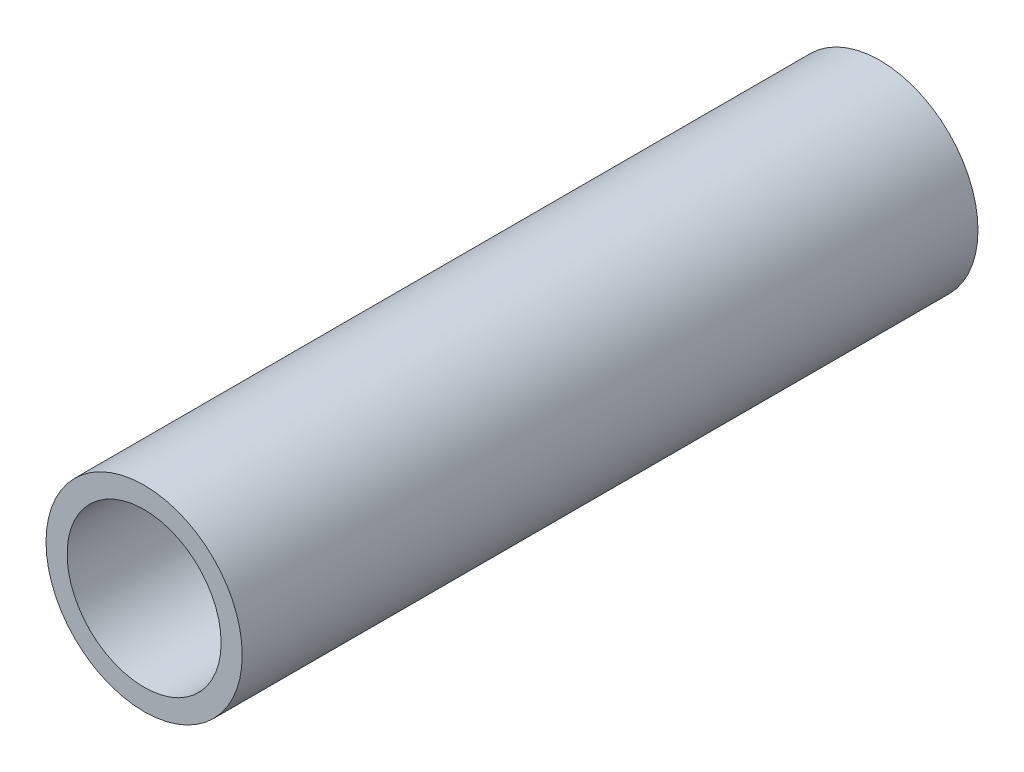
from build123d import *

# Parameters (mm, degrees)
BOSS_EXTRUDE1_DEPTH      = 50
BOSS_EXTRUDE1_DEPTH_BACK = 50
SKETCH3_R                = 13.335
SKETCH3_R_2              = 10.4648


with BuildPart() as part:
    # Sketch3 → Boss-Extrude1 (new, two sides: drawn at the far end of the back side and taken through both)
    with BuildSketch(Plane.XY.offset(-BOSS_EXTRUDE1_DEPTH_BACK)):
        Circle(SKETCH3_R)
        Circle(SKETCH3_R_2, mode=Mode.SUBTRACT)
    extrude(amount=BOSS_EXTRUDE1_DEPTH + BOSS_EXTRUDE1_DEPTH_BACK)


solid = part.part
